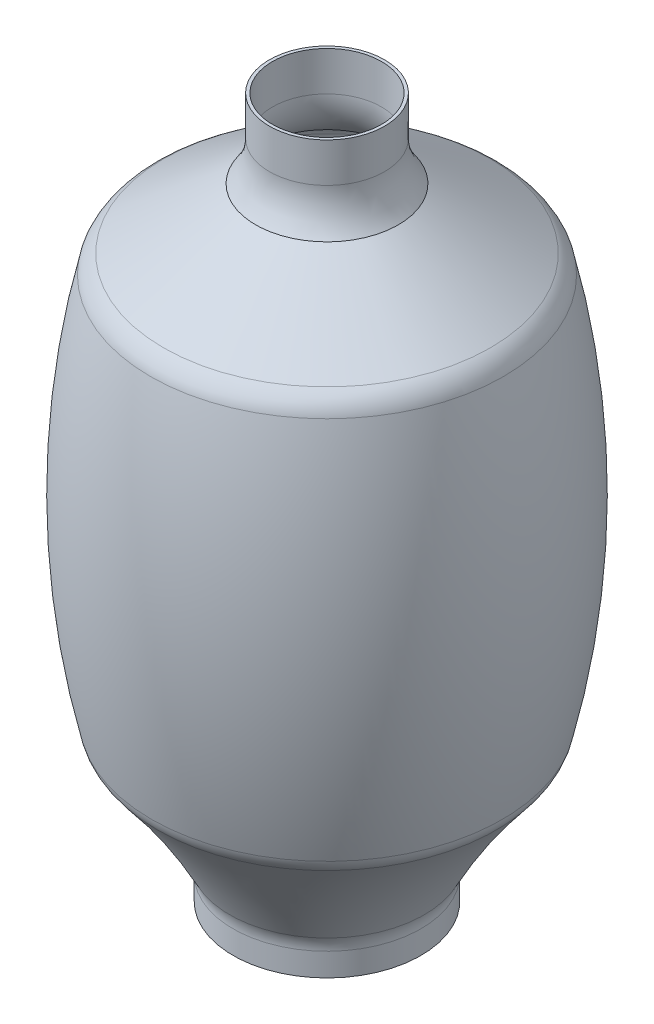
from build123d import *

# Parameters (mm, degrees)
REDONDEO1_R = 10
REDONDEO2_R = 10
VACIADO1_T  = -1


with BuildPart() as part:
    # Croquis1 → Revolución2 (revolve)
    with BuildSketch(Plane.XY, mode=Mode.PRIVATE) as revoluci_n2_sk:
        with BuildLine():
            Line((57.3, 133), (57.3, 181))
            Line((57.3, 181), (38.3, 181))
            Line((38.3, 181), (38.3, 168))
            ThreePointArc((38.3, 168), (37.196804423, 161.132834072), (33.740285031, 155.097315696))
            Line((33.740285031, 155.097315696), (0, 133))
            ThreePointArc((0, 133), (-8.100855338, 66.5), (0, 0))
            ThreePointArc((0, 0), (14.37735085, -19.193016816), (26.3, -40))
            Line((26.3, -40), (26.3, -50))
            Line((26.3, -50), (57.3, -50))
            Line((57.3, -50), (57.3, 0))
            Line((57.3, 0), (57.3, 133))
        make_face()
    revolve(revoluci_n2_sk.sketch.rotate(Axis((57.3, 0, 0), (0, 1, 0)), 270), axis=Axis((57.3, 0, 0), (0, 1, 0)))

    # Redondeo1
    redondeo1_edges = [part.edges().sort_by_distance(p)[0] for p in [
        (57.3, 133, 57.3),
    ]]
    fillet(redondeo1_edges, radius=REDONDEO1_R)

    # Redondeo2
    redondeo2_edges = [part.edges().sort_by_distance(p)[0] for p in [
        (57.3, 0, 57.3),
        (57.3, -40, 31),
    ]]
    fillet(redondeo2_edges, radius=REDONDEO2_R)

    # Vaciado1
    vaciado1_openings = [part.faces().sort_by_distance(p)[0] for p in [
        (57.3, -50, 0),
        (57.3, 181, 0),
    ]]
    offset(amount=VACIADO1_T, openings=vaciado1_openings, kind=Kind.INTERSECTION)


solid = part.part
